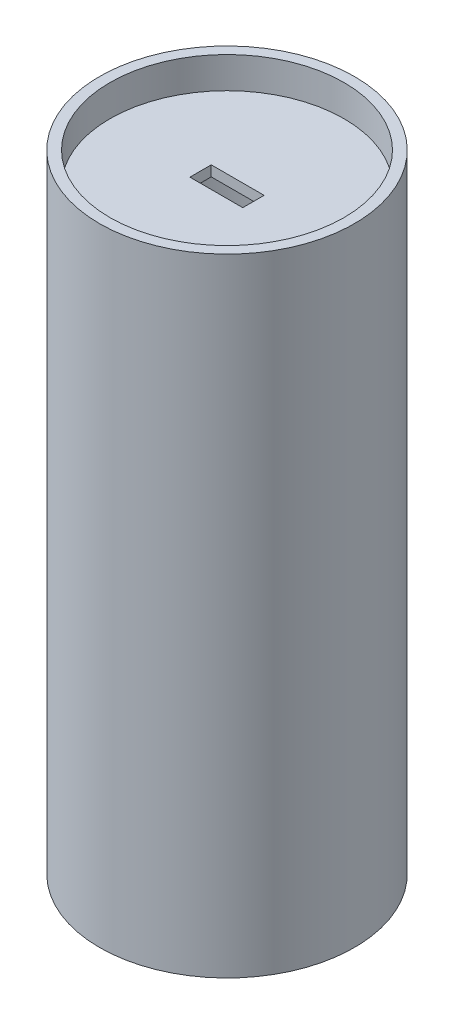
from build123d import *

# Parameters (mm, degrees)
SKETCH1_R           = 61
SKETCH1_R_2         = 56
BOSS_EXTRUDE1_DEPTH = 300
SKETCH3_R           = 56
BOSS_EXTRUDE2_DEPTH = 5
CUT_EXTRUDE1_REACH  = 294.988
SKETCH4_R           = 1.5
SKETCH5_R           = 56
BOSS_EXTRUDE3_DEPTH = 5
CUT_EXTRUDE2_REACH  = 299.77
SKETCH6_W           = 25.301187414
SKETCH6_H           = 10.224452448


with BuildPart() as part:
    # Sketch1 → Boss-Extrude1 (new body)
    with BuildSketch(Plane(origin=(0, 0, 0), x_dir=(1, 0, 0), z_dir=(0, 1, 0))):
        with Locations(Location((0, 0, 0), (0, 0, 270))):
            Circle(SKETCH1_R)
        with Locations(Location((0, 0, 0), (0, 0, 270))):
            Circle(SKETCH1_R_2, mode=Mode.SUBTRACT)
    extrude(amount=BOSS_EXTRUDE1_DEPTH)

    # Sketch3 → Boss-Extrude2 (add)
    with BuildSketch(Plane(origin=(0, 20, 0), x_dir=(1, 0, 0), z_dir=(0, 1, 0))):
        with Locations(Location((0, 0, 0), (0, 0, 270))):
            Circle(SKETCH3_R)
    extrude(amount=BOSS_EXTRUDE2_DEPTH)

    # Sketch4 → Cut-Extrude1 (cut, up to next)
    with BuildSketch(Plane.XZ.offset(-20), mode=Mode.PRIVATE) as cut_extrude1_sk1:
        with Locations(Location((-3, 0, 0), (0, 0, 270))):
            Circle(SKETCH4_R)
    cut_extrude1_tool1 = extrude(cut_extrude1_sk1.sketch, amount=-CUT_EXTRUDE1_REACH, mode=Mode.PRIVATE) & part.part
    # Sketch4 → Cut-Extrude1 (cut, up to next)
    with BuildSketch(Plane.XZ.offset(-20), mode=Mode.PRIVATE) as cut_extrude1_sk2:
        with Locations(Location((3, 0, 0), (0, 0, 270))):
            Circle(SKETCH4_R)
    cut_extrude1_tool2 = extrude(cut_extrude1_sk2.sketch, amount=-CUT_EXTRUDE1_REACH, mode=Mode.PRIVATE) & part.part
    add(cut_extrude1_tool1.solids().sort_by_distance((-3, 20, 0))[0], mode=Mode.SUBTRACT)
    add(cut_extrude1_tool2.solids().sort_by_distance((3, 20, 0))[0], mode=Mode.SUBTRACT)

    # Sketch5 → Boss-Extrude3 (add)
    with BuildSketch(Plane(origin=(0, 280, 0), x_dir=(1, 0, 0), z_dir=(0, 1, 0))):
        with Locations(Location((0, 0, 0), (0, 0, 270))):
            Circle(SKETCH5_R)
    extrude(amount=BOSS_EXTRUDE3_DEPTH)

    # Sketch6 → Cut-Extrude2 (cut, up to next)
    with BuildSketch(Plane(origin=(0, 285, 0), x_dir=(1, 0, 0), z_dir=(0, 1, 0)), mode=Mode.PRIVATE) as cut_extrude2_sk1:
        Rectangle(SKETCH6_W, SKETCH6_H)
    cut_extrude2_tool1 = extrude(cut_extrude2_sk1.sketch, amount=-CUT_EXTRUDE2_REACH, mode=Mode.PRIVATE) & part.part
    add(cut_extrude2_tool1.solids().sort_by_distance((0, 285, 0))[0], mode=Mode.SUBTRACT)


solid = part.part
